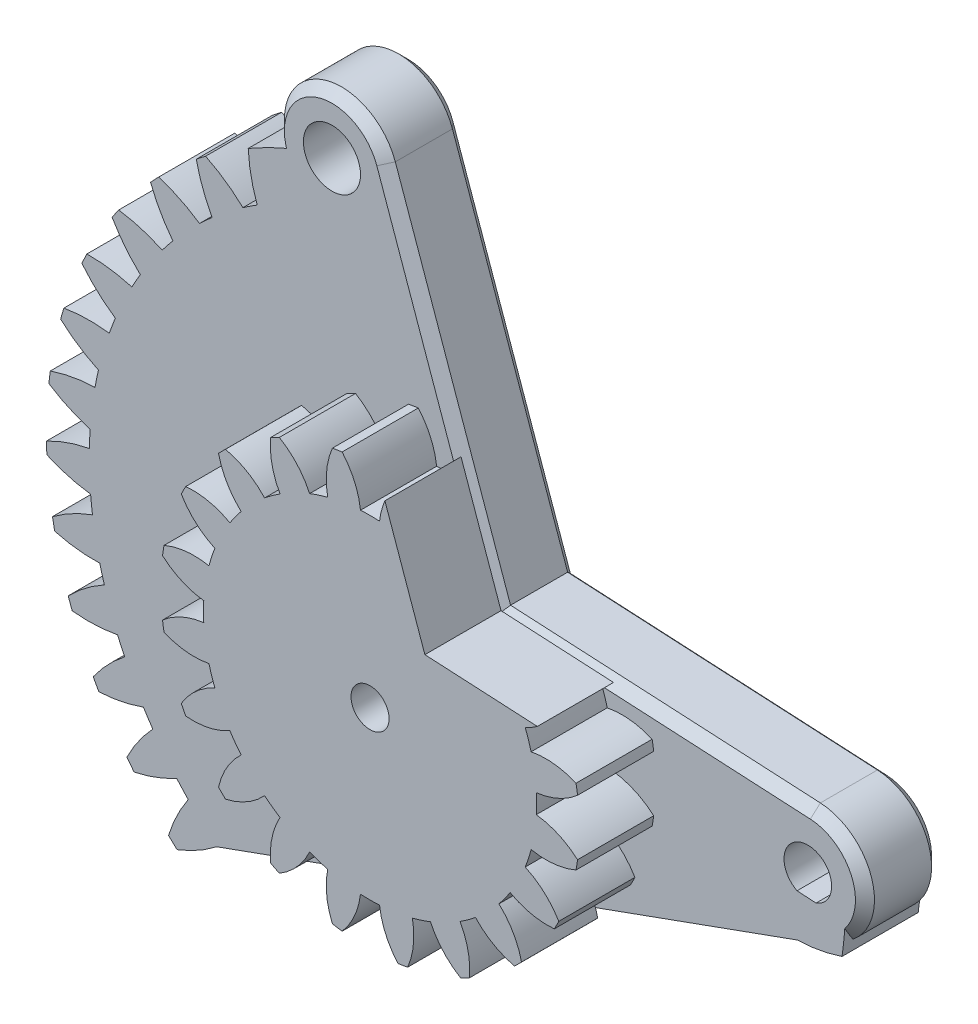
from build123d import *

# Parameters (mm, degrees)
CROQUIS1_R              = 1
CROQUIS1_R_2            = 1.25
SALIENTE_EXTRUIR1_DEPTH = 4
CROQUIS2_R              = 1
CROQUIS2_R_2            = 1.5
SALIENTE_EXTRUIR2_DEPTH = 4
CHAFL_N1_SIZE           = 0.5
SALIENTE_EXTRUIR3_DEPTH = 4
CORTAR_EXTRUIR1_DEPTH   = 10
MATRIZC1_COUNT          = 26
MATRIZC1_ANGLE          = 225
CORTAR_EXTRUIR3_DEPTH   = 10
CROQUIS7_R              = 11
CROQUIS7_R_2            = 1
SALIENTE_EXTRUIR4_DEPTH = 4
CORTAR_EXTRUIR2_DEPTH   = 4
MATRIZC2_COUNT          = 20
CORTAR_EXTRUIR4_DEPTH   = 33.817678254


with BuildPart() as part:
    # Croquis1 → Saliente-Extruir1 (new body)
    with BuildSketch(Plane.XY):
        with BuildLine():
            Line((0.210526316, 3.994455992), (19.157894737, 2.995841994))
            ThreePointArc((19.157894737, 2.995841994), (22, 0), (19.157894737, -2.995841994))
            Line((19.157894737, -2.995841994), (0.210526316, -3.994455992))
            ThreePointArc((0.210526316, -3.994455992), (-4, 0), (0.210526316, 3.994455992))
        make_face()
        Circle(CROQUIS1_R, mode=Mode.SUBTRACT)
        with Locations((19, 0)):
            Circle(CROQUIS1_R_2, mode=Mode.SUBTRACT)
    extrude(amount=SALIENTE_EXTRUIR1_DEPTH)

    # Croquis2 → Saliente-Extruir2 (add, through all)
    with BuildSketch(Plane.XY.offset(4)):
        with BuildLine():
            Line((-3.171102714, 20.998669186), (3.771863049, 1.331558915))
            ThreePointArc((3.771863049, 1.331558915), (1.149391542, -3.831305141), (-3.881954792, -0.964586438))
            Line((-3.881954792, -0.964586438), (-8.911466094, 19.276560172))
            ThreePointArc((-8.911466094, 19.276560172), (-6.862043657, 22.873478856), (-3.171102714, 20.998669186))
        make_face()
        Circle(CROQUIS2_R, mode=Mode.SUBTRACT)
        with Locations((-6, 20)):
            Circle(CROQUIS2_R_2, mode=Mode.SUBTRACT)
    extrude(amount=-SALIENTE_EXTRUIR2_DEPTH)

    # Chaflán1
    chafl_n1_edges = [part.edges().sort_by_distance(p)[0] for p in [
        (22, 0, 4),
        (11.01969335, 3.424762868, 4),
        (-2.380099608, -3.214829056, 0),
        (-2.380099608, -3.214829056, 4),
        (-0.144805375, 12.426176464, 0),
        (-0.144805375, 12.426176464, 4),
        (-6.862043657, 22.873478856, 4),
        (-6.396710443, 9.155986867, 4),
        (-6.862043657, 22.873478856, 0),
        (-6.396710443, 9.155986867, 0),
        (11.01969335, 3.424762868, 0),
        (22, 0, 0),
        (9.684210526, -3.495148993, 0),
        (9.684210526, -3.495148993, 4),
    ]]
    chamfer(chafl_n1_edges, length=CHAFL_N1_SIZE)

    # Croquis5 → Saliente-Extruir3 (add, through all)
    with BuildSketch(Plane.XY.offset(4)):
        with BuildLine():
            Line((-8.12542173, 19.364336335), (-0.386924844, 0.922111254))
            ThreePointArc((-0.386924844, 0.922111254), (-0.578520438, -0.815667887), (0.998180987, -0.060288623))
            Line((0.998180987, -0.060288623), (20.961800718, -1.266061076))
            ThreePointArc((20.961800718, -1.266061076), (-12.148929201, -17.129025637), (-8.12542173, 19.364336335))
        make_face()
    extrude(amount=-SALIENTE_EXTRUIR3_DEPTH)

    # Croquis4 → Cortar-Extruir1 (cut)
    with BuildSketch(Plane.XY):
        with BuildLine():
            ThreePointArc((-9.927829924, 15.904816692), (-10.305597324, 15.662683831), (-10.677462175, 15.411580143))
            ThreePointArc((-10.677462175, 15.411580143), (-11.618969557, 16.172794781), (-12.664568115, 16.783210647))
            ThreePointArc((-12.664568115, 16.783210647), (-11.556846017, 17.564360373), (-10.401093383, 18.272512186))
            ThreePointArc((-10.401093383, 18.272512186), (-10.254302252, 17.070706778), (-9.927829924, 15.904816692))
        make_face()
    cortar_extruir1 = extrude(amount=CORTAR_EXTRUIR1_DEPTH, mode=Mode.SUBTRACT)

    # MatrizC1: Cortar-Extruir1 ×26 about axis
    matrizc1_axis = Axis((0, 0, 0), (0, 0, 1))
    for i in range(1, MATRIZC1_COUNT):
        add(cortar_extruir1.rotate(matrizc1_axis, i * MATRIZC1_ANGLE / (MATRIZC1_COUNT - 1)), mode=Mode.SUBTRACT)

    # Croquis9 → Cortar-Extruir3 (cut)
    with BuildSketch(Plane.XY.offset(4)):
        Polygon((-12.058511391, -14.356785992), (18.447738738, -3.347526918), (41.792644194, -9.999013948), (3.330495337, -34.929313287), (-27.12510491, -28.428214003), align=None)
    extrude(amount=-CORTAR_EXTRUIR3_DEPTH, mode=Mode.SUBTRACT)

    # Croquis7 → Saliente-Extruir4 (add)
    with BuildSketch(Plane.XY.offset(4)):
        with Locations(Location((0, 0, 0), (0, 0, 258.663448558))):
            Circle(CROQUIS7_R)
        Circle(CROQUIS7_R_2, mode=Mode.SUBTRACT)
    extrude(amount=SALIENTE_EXTRUIR4_DEPTH)

    # Croquis8 → Cortar-Extruir2 (cut)
    with BuildSketch(Plane.XY.offset(8)):
        with BuildLine():
            ThreePointArc((0.499924007, 8.734705318), (0, 8.749), (-0.499924007, 8.734705318))
            ThreePointArc((-0.499924007, 8.734705318), (-0.824302243, 9.905497836), (-1.485192705, 10.924909509))
            ThreePointArc((-1.485192705, 10.924909509), (0, 11.0254), (1.485192705, 10.924909509))
            ThreePointArc((1.485192705, 10.924909509), (0.824302243, 9.905497836), (0.499924007, 8.734705318))
        make_face()
    cortar_extruir2 = extrude(amount=-CORTAR_EXTRUIR2_DEPTH, mode=Mode.SUBTRACT)

    # MatrizC2: Cortar-Extruir2 ×20 about axis
    matrizc2_axis = Axis((0, 0, 0), (0, 0, 1))
    for i in range(1, MATRIZC2_COUNT):
        add(cortar_extruir2.rotate(matrizc2_axis, i * 360 / MATRIZC2_COUNT), mode=Mode.SUBTRACT)

    # Croquis10 → Cortar-Extruir4 (cut, through all)
    with BuildSketch(Plane.XY.offset(8)):
        Polygon((-3.171102714, 20.998669186), (2.881491963, 3.853683742), (19.157894737, 2.995841994), (14.48034999, 14.875561219), align=None)
    extrude(amount=-CORTAR_EXTRUIR4_DEPTH, mode=Mode.SUBTRACT)


solid = part.part
